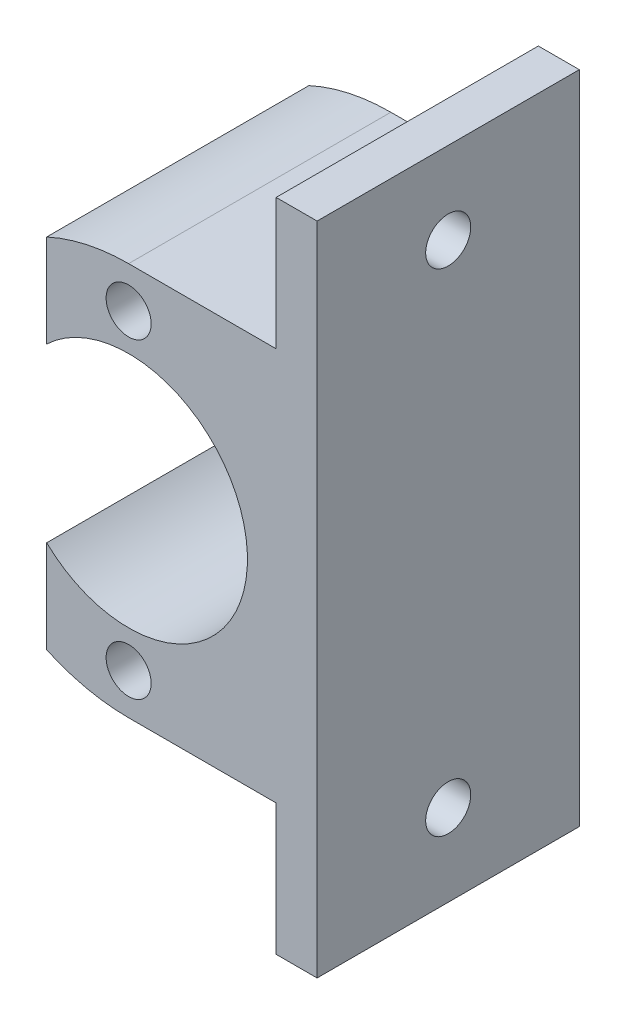
from build123d import *

# Parameters (mm, degrees)
ESQUISSE2_R        = 2.75
BOSS_EXTRU_1_DEPTH = 32
ESQUISSE3_W        = 32
ESQUISSE3_H        = 16
ESQUISSE3_R        = 2.75
BOSS_EXTRU_2_DEPTH = 5


with BuildPart() as part:
    # Esquisse2 → Boss.-Extru.1 (new body)
    with BuildSketch(Plane.XY):
        with BuildLine():
            Line((-5.48727754, 19.978225401), (17.51272246, 19.978225401))
            Line((17.51272246, 19.978225401), (17.51272246, -28.021774599))
            Line((17.51272246, -28.021774599), (-5.48727754, -28.021774599))
            ThreePointArc((-5.48727754, -28.021774599), (-10.604983007, -27.469782846), (-15.48727754, -25.839198829))
            Line((-15.48727754, -25.839198829), (-15.48727754, -14.521774599))
            ThreePointArc((-15.48727754, -14.521774599), (9.01272246, -4.021774599), (-15.48727754, 6.478225401))
            Line((-15.48727754, 6.478225401), (-15.48727754, 17.79564963))
            ThreePointArc((-15.48727754, 17.79564963), (-10.604983007, 19.426233648), (-5.48727754, 19.978225401))
        make_face()
        with Locations((-5.48727754, 14.978225401)):
            Circle(ESQUISSE2_R, mode=Mode.SUBTRACT)
        with Locations((-5.48727754, -23.021774599)):
            Circle(ESQUISSE2_R, mode=Mode.SUBTRACT)
    extrude(amount=BOSS_EXTRU_1_DEPTH)

    # Esquisse3 → Boss.-Extru.2 (add)
    # profile 1 of 2: a face of its own
    with BuildSketch(Plane(origin=(17.51272246, 0, 0), x_dir=(0, 0, -1), z_dir=(1, 0, 0))):
        with Locations((-16, 27.978225401)):
            Rectangle(ESQUISSE3_W, ESQUISSE3_H)
        with Locations(Location((-16, 25.978225401, 0), (0, 0, 90))):
            Circle(ESQUISSE3_R, mode=Mode.SUBTRACT)
    # profile 2 of 2: a face of its own
    with BuildSketch(Plane(origin=(17.51272246, 0, 0), x_dir=(0, 0, -1), z_dir=(1, 0, 0))):
        with Locations((-16, -36.021774599)):
            Rectangle(ESQUISSE3_W, ESQUISSE3_H)
        with Locations(Location((-16, -34.021774599, 0), (0, 0, 90))):
            Circle(ESQUISSE3_R, mode=Mode.SUBTRACT)
    extrude(amount=-BOSS_EXTRU_2_DEPTH)


solid = part.part
